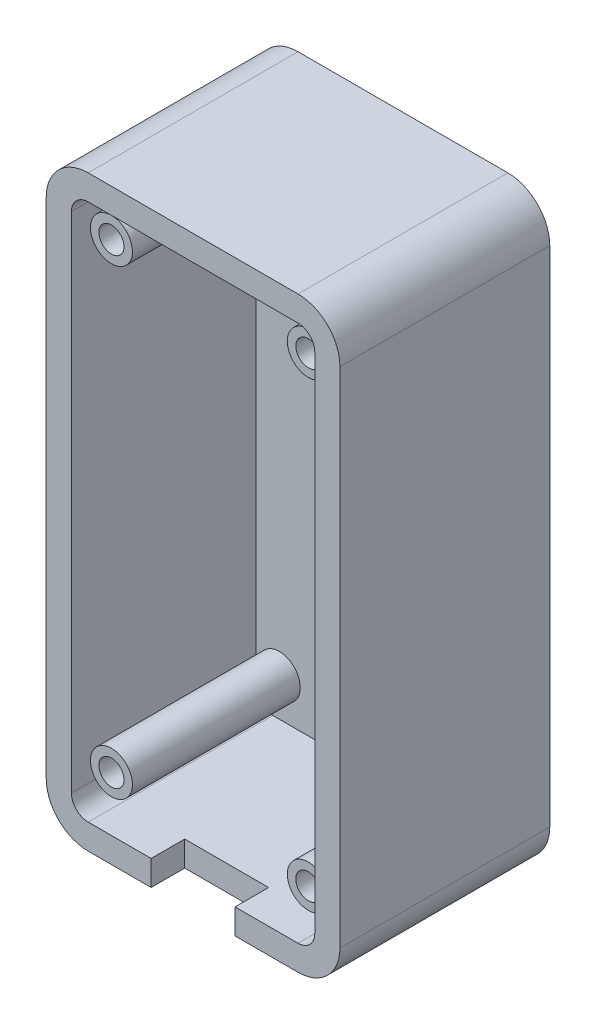
from build123d import *

# Parameters (mm, degrees)
EXTRUDE_1_DEPTH           = 25
SHELL_2_T                 = -3
SKETCH_3_R                = 2.5
EXTRUDE_4_DEPTH           = 20
CUT_EXTRUDE_4_DEPTH       = 212.557459677
CUT_EXTRUDE_4_DEPTH_BACK  = 212.557459677
SKETCH_4_R                = 1.5
CUT_EXTRUDE_10_DEPTH      = 5
CUT_EXTRUDE_10_DEPTH_BACK = 212.890440429


with BuildPart() as part:
    # 草图1 → 凸台-拉伸1 (new body)
    with BuildSketch(Plane.XY):
        with BuildLine():
            Line((-193.42519685, 70), (-168.42519685, 70))
            ThreePointArc((-168.42519685, 70), (-164.889662944, 68.535533906), (-163.42519685, 65))
            Line((-163.42519685, 65), (-163.42519685, 5))
            ThreePointArc((-163.42519685, 5), (-164.889662944, 1.464466094), (-168.42519685, 0))
            Line((-168.42519685, 0), (-193.42519685, 0))
            ThreePointArc((-193.42519685, 0), (-196.960730756, 1.464466094), (-198.42519685, 5))
            Line((-198.42519685, 5), (-198.42519685, 65))
            ThreePointArc((-198.42519685, 65), (-196.960730756, 68.535533906), (-193.42519685, 70))
        make_face()
    extrude(amount=EXTRUDE_1_DEPTH)

    # 抽壳2
    shell_2_openings = [part.faces().sort_by_distance(p)[0] for p in [
        (-180.92519685, 35, 25),
    ]]
    offset(amount=SHELL_2_T, openings=shell_2_openings, kind=Kind.INTERSECTION)

    # 草图3 → 凸台-拉伸4 (add)
    with BuildSketch(Plane.XY.offset(3)):
        with Locations((-192.656739456, 62.5)):
            Circle(SKETCH_3_R)
        with Locations((-192.656739456, 7.5)):
            Circle(SKETCH_3_R)
        with Locations((-169.193654245, 62.5)):
            Circle(SKETCH_3_R)
        with Locations((-169.193654245, 7.5)):
            Circle(SKETCH_3_R)
    extrude(amount=EXTRUDE_4_DEPTH)

    # 草图4 → 切除-拉伸4 (cut, two sides: drawn at the far end of the back side and taken through both)
    with BuildSketch(Plane.XY.offset(3).offset(-CUT_EXTRUDE_4_DEPTH_BACK)):
        with Locations((-192.656739456, 62.5)):
            Circle(SKETCH_4_R)
        with Locations((-169.193654245, 62.5)):
            Circle(SKETCH_4_R)
        with Locations((-169.193654245, 7.5)):
            Circle(SKETCH_4_R)
        with Locations((-192.656739456, 7.5)):
            Circle(SKETCH_4_R)
    extrude(amount=CUT_EXTRUDE_4_DEPTH + CUT_EXTRUDE_4_DEPTH_BACK, mode=Mode.SUBTRACT)

    # 草图6 → 切除-拉伸10 (cut, two sides: drawn at the far end of the back side and taken through both)
    with BuildSketch(Plane(origin=(0, 0, 0), x_dir=(1, 0, 0), z_dir=(0, 1, 0)).offset(-CUT_EXTRUDE_10_DEPTH_BACK)):
        Polygon((-180.92519685, -25), (-175.92519685, -25), (-175.92519685, -21), (-185.92519685, -21), (-185.92519685, -25), align=None)
    extrude(amount=CUT_EXTRUDE_10_DEPTH + CUT_EXTRUDE_10_DEPTH_BACK, mode=Mode.SUBTRACT)


solid = part.part
